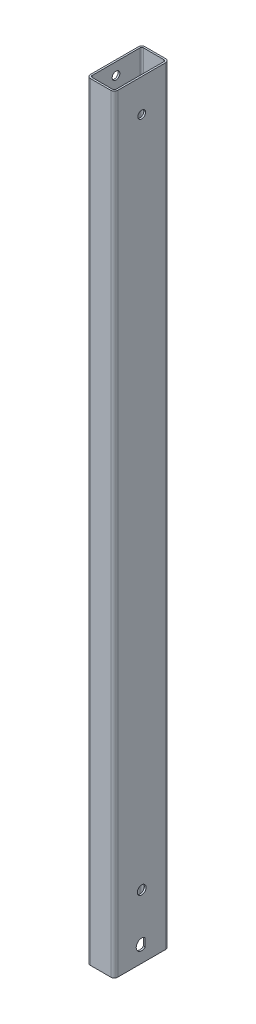
from build123d import *

# Parameters (mm, degrees)
SKETCH1_W           = 50
SKETCH1_H           = 700
SKETCH1_R           = 5
BOSS_EXTRUDE1_DEPTH = 12.5
BOSS_EXTRUDE2_START = -25
BOSS_EXTRUDE2_DEPTH = 25
FILLET1_R           = 1
FILLET2_R           = 3.2
CUT_EXTRUDE2_DEPTH  = 701.55781346
CUT_EXTRUDE3_REACH  = 687.912
SKETCH5_R           = 4
CUT_EXTRUDE4_REACH  = 687.912
SKETCH6_R           = 3.5
CUT_EXTRUDE5_REACH  = 688.936
SKETCH7_R           = 5
CUT_EXTRUDE6_REACH  = 687.912
SKETCH8_R           = 3.5


with BuildPart() as part:
    # Sketch1 → Boss-Extrude1 (new, symmetric)
    with BuildSketch(Plane(origin=(0, 0, 0), x_dir=(0, 0, -1), z_dir=(1, 0, 0))):
        with Locations((0, 335)):
            Rectangle(SKETCH1_W, SKETCH1_H)
        Circle(SKETCH1_R, mode=Mode.SUBTRACT)
    extrude(amount=BOSS_EXTRUDE1_DEPTH, both=True)

    # Sketch2 → Boss-Extrude2 (add)
    with BuildSketch(Plane(origin=(12.5, 0, 0), x_dir=(0, 0, -1), z_dir=(1, 0, 0)).offset(BOSS_EXTRUDE2_START)):
        with BuildLine():
            Line((3, 4), (3, -4))
            ThreePointArc((3, -4), (5, 0), (3, 4))
        make_face()
    extrude(amount=BOSS_EXTRUDE2_DEPTH)

    # Fillet1
    fillet1_edges = [part.edges().sort_by_distance(p)[0] for p in [
        (0, -4, -3),
        (0, 4, -3),
    ]]
    fillet(fillet1_edges, radius=FILLET1_R)

    # Fillet2
    fillet2_edges = [part.edges().sort_by_distance(p)[0] for p in [
        (12.5, 335, 25),
        (12.5, 335, -25),
        (-12.5, 335, 25),
        (-12.5, 335, -25),
    ]]
    fillet(fillet2_edges, radius=FILLET2_R)

    # Sketch4 → Cut-Extrude2 (cut, through all)
    with BuildSketch(Plane.XZ.offset(15)):
        with BuildLine():
            Line((-9.3, -23.4), (9.3, -23.4))
            ThreePointArc((9.3, -23.4), (10.43137085, -22.93137085), (10.9, -21.8))
            Line((10.9, -21.8), (10.9, 21.8))
            ThreePointArc((10.9, 21.8), (10.43137085, 22.93137085), (9.3, 23.4))
            Line((9.3, 23.4), (-9.3, 23.4))
            ThreePointArc((-9.3, 23.4), (-10.43137085, 22.93137085), (-10.9, 21.8))
            Line((-10.9, 21.8), (-10.9, -21.8))
            ThreePointArc((-10.9, -21.8), (-10.43137085, -22.93137085), (-9.3, -23.4))
        make_face()
    extrude(amount=-CUT_EXTRUDE2_DEPTH, mode=Mode.SUBTRACT)

    # Sketch5 → Cut-Extrude3 (cut, up to next)
    with BuildSketch(Plane(origin=(12.5, 0, 0), x_dir=(0, 0, -1), z_dir=(1, 0, 0)), mode=Mode.PRIVATE) as cut_extrude3_sk1:
        with Locations((0, 43)):
            Circle(SKETCH5_R)
    cut_extrude3_tool1 = extrude(cut_extrude3_sk1.sketch, amount=-CUT_EXTRUDE3_REACH, mode=Mode.PRIVATE) & part.part
    add(cut_extrude3_tool1.solids().sort_by_distance((12.5, 43, 0))[0], mode=Mode.SUBTRACT)

    # Sketch6 → Cut-Extrude4 (cut, up to next)
    with BuildSketch(Plane(origin=(12.5, 0, 0), x_dir=(0, 0, -1), z_dir=(1, 0, 0)), mode=Mode.PRIVATE) as cut_extrude4_sk1:
        with Locations((0, 655)):
            Circle(SKETCH6_R)
    cut_extrude4_tool1 = extrude(cut_extrude4_sk1.sketch, amount=-CUT_EXTRUDE4_REACH, mode=Mode.PRIVATE) & part.part
    add(cut_extrude4_tool1.solids().sort_by_distance((12.5, 655, 0))[0], mode=Mode.SUBTRACT)

    # Sketch7 → Cut-Extrude5 (cut, up to next)
    with BuildSketch(Plane(origin=(0, 0, -25), x_dir=(-1, 0, 0), z_dir=(0, 0, -1)), mode=Mode.PRIVATE) as cut_extrude5_sk1:
        with Locations((0, 665)):
            Circle(SKETCH7_R)
    cut_extrude5_tool1 = extrude(cut_extrude5_sk1.sketch, amount=-CUT_EXTRUDE5_REACH, mode=Mode.PRIVATE) & part.part
    # Sketch7 → Cut-Extrude5 (cut, up to next)
    with BuildSketch(Plane(origin=(0, 0, -25), x_dir=(-1, 0, 0), z_dir=(0, 0, -1)), mode=Mode.PRIVATE) as cut_extrude5_sk2:
        with Locations((0, 565)):
            Circle(SKETCH7_R)
    cut_extrude5_tool2 = extrude(cut_extrude5_sk2.sketch, amount=-CUT_EXTRUDE5_REACH, mode=Mode.PRIVATE) & part.part
    add(cut_extrude5_tool1.solids().sort_by_distance((0, 665, -25))[0], mode=Mode.SUBTRACT)
    add(cut_extrude5_tool2.solids().sort_by_distance((0, 565, -25))[0], mode=Mode.SUBTRACT)

    # Sketch8 → Cut-Extrude6 (cut, up to next)
    with BuildSketch(Plane.ZY.offset(12.5), mode=Mode.PRIVATE) as cut_extrude6_sk1:
        with Locations((0, 674)):
            Circle(SKETCH8_R)
    cut_extrude6_tool1 = extrude(cut_extrude6_sk1.sketch, amount=-CUT_EXTRUDE6_REACH, mode=Mode.PRIVATE) & part.part
    # Sketch8 → Cut-Extrude6 (cut, up to next)
    with BuildSketch(Plane.ZY.offset(12.5), mode=Mode.PRIVATE) as cut_extrude6_sk2:
        with Locations((0, 656)):
            Circle(SKETCH8_R)
    cut_extrude6_tool2 = extrude(cut_extrude6_sk2.sketch, amount=-CUT_EXTRUDE6_REACH, mode=Mode.PRIVATE) & part.part
    add(cut_extrude6_tool1.solids().sort_by_distance((-12.5, 674, 0))[0], mode=Mode.SUBTRACT)
    add(cut_extrude6_tool2.solids().sort_by_distance((-12.5, 656, 0))[0], mode=Mode.SUBTRACT)


solid = part.part
